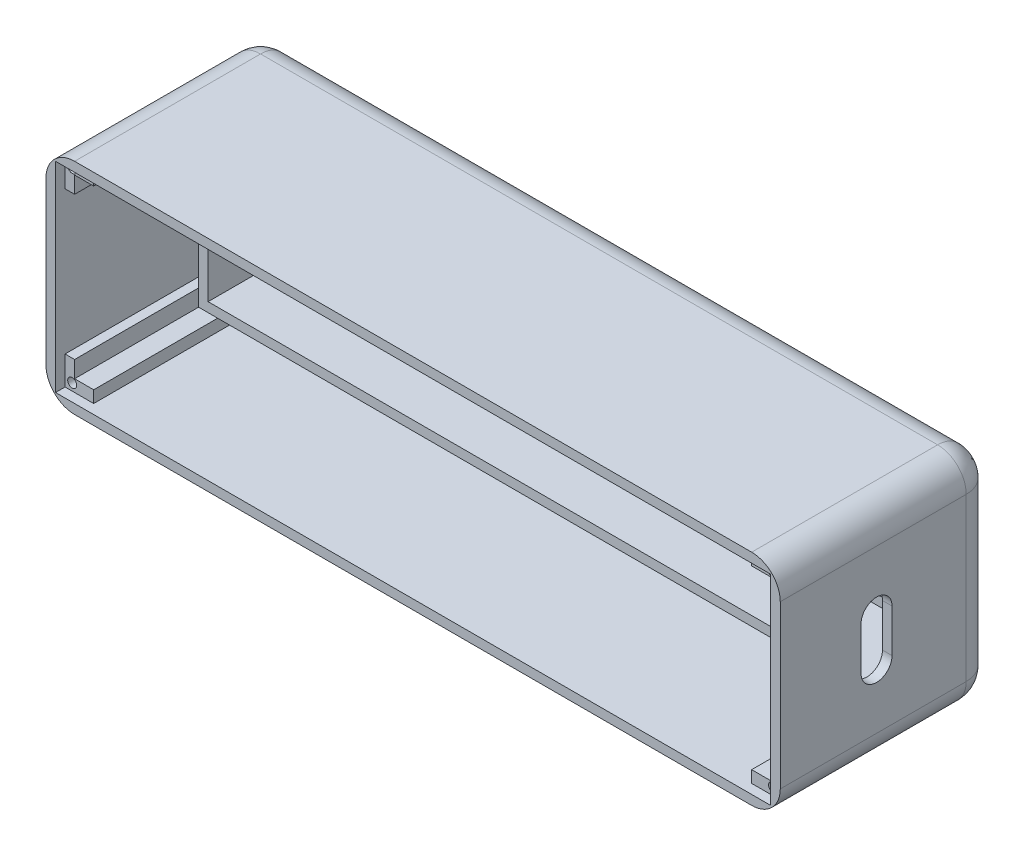
from build123d import *

# Parameters (mm, degrees)
SKETCH_1_W          = 154
SKETCH_1_H          = 46
SKETCH_1_W_2        = 150
SKETCH_1_H_2        = 42
EXTRUDE_1_DEPTH     = 43
SKETCH_2_W          = 154
SKETCH_2_H          = 46
EXTRUDE_2_DEPTH     = 2
SKETCH_3_W          = 137.467290134
SKETCH_3_H          = 29
CUT_EXTRUDE_1_DEPTH = 2
SKETCH_3_4_W        = 146
SKETCH_3_4_H        = 37
SKETCH_3_4_W_2      = 142
SKETCH_3_4_H_2      = 33
EXTRUDE_3_DEPTH     = 15
EXTRUDE_9_DEPTH     = 41
SKETCH_8_R          = 0.95
CUT_EXTRUDE_2_DEPTH = 41
FILLET_2_R          = 6
FILLET_3_R          = 6
CUT_EXTRUDE_3_DEPTH = 41


with BuildPart() as part:
    # 草图1 → 凸台-拉伸1 (new body)
    with BuildSketch(Plane.XY):
        with Locations((1.242355366, -16.575185829)):
            Rectangle(SKETCH_1_W, SKETCH_1_H)
        with Locations((1.242355366, -16.575185829)):
            Rectangle(SKETCH_1_W_2, SKETCH_1_H_2, mode=Mode.SUBTRACT)
    extrude(amount=EXTRUDE_1_DEPTH)

    # 草图2 → 凸台-拉伸2 (add)
    with BuildSketch(Plane(origin=(0, 0, 0), x_dir=(-1, 0, 0), z_dir=(0, 0, -1))):
        with Locations((-1.242355366, -16.575185829)):
            Rectangle(SKETCH_2_W, SKETCH_2_H)
    extrude(amount=EXTRUDE_2_DEPTH)

    # 草图3 → 切除-拉伸1 (cut)
    with BuildSketch(Plane.XY):
        with Locations((1.508710299, -16.575185829)):
            Rectangle(SKETCH_3_W, SKETCH_3_H)
    extrude(amount=-CUT_EXTRUDE_1_DEPTH, mode=Mode.SUBTRACT)

    # 草图3<4> → 凸台-拉伸3 (add)
    with BuildSketch(Plane.XY):
        with Locations((1.242355366, -16.575185829)):
            Rectangle(SKETCH_3_4_W, SKETCH_3_4_H)
        with Locations((1.242355366, -16.575185829)):
            Rectangle(SKETCH_3_4_W_2, SKETCH_3_4_H_2, mode=Mode.SUBTRACT)
    extrude(amount=EXTRUDE_3_DEPTH)

    # 草图7 → 凸台-拉伸9 (add)
    with BuildSketch(Plane.XY):
        Polygon((-73.757644634, 4.424814171), (-67.757644634, 4.424814171), (-67.757644634, 1.924814171), (-71.757644634, 1.924814171), (-71.757644634, -1.575185829), (-73.757644634, -1.575185829), align=None)
        Polygon((74.242355366, -1.575185829), (76.242355366, -1.575185829), (76.242355366, 4.424814171), (70.242355366, 4.424814171), (70.242355366, 1.924814171), (74.242355366, 1.924814171), align=None)
        Polygon((74.242355366, -35.075185829), (74.242355366, -31.575185829), (76.242355366, -31.575185829), (76.242355366, -37.575185829), (70.242355366, -37.575185829), (70.242355366, -35.075185829), align=None)
        Polygon((-71.757644634, -31.575185829), (-73.757644634, -31.575185829), (-73.757644634, -37.575185829), (-67.757644634, -37.575185829), (-67.757644634, -35.075185829), (-71.757644634, -35.075185829), align=None)
    extrude(amount=EXTRUDE_9_DEPTH)

    # 草图8 → 切除-拉伸2 (cut)
    with BuildSketch(Plane.XY.offset(41)):
        with Locations((-72.257644634, 2.924814171)):
            Circle(SKETCH_8_R)
        with Locations((-72.257644634, -36.075185829)):
            Circle(SKETCH_8_R)
        with Locations((74.742355366, -36.075185829)):
            Circle(SKETCH_8_R)
        with Locations((74.742355366, 2.924814171)):
            Circle(SKETCH_8_R)
    extrude(amount=-CUT_EXTRUDE_2_DEPTH, mode=Mode.SUBTRACT)

    # 圆角2
    fillet_2_edges = [part.edges().sort_by_distance(p)[0] for p in [
        (78.242355366, -39.575185829, 20.5),
        (78.242355366, 6.424814171, 20.5),
        (-75.757644634, -39.575185829, 20.5),
        (-75.757644634, 6.424814171, 20.5),
    ]]
    fillet(fillet_2_edges, radius=FILLET_2_R)

    # 圆角3
    fillet_3_edges = [part.edges().sort_by_distance(p)[0] for p in [
        (76.484996053, 4.667454858, -2),
        (1.242355366, 6.424814171, -2),
        (-74.000285321, 4.667454858, -2),
        (-75.757644634, -16.575185829, -2),
        (-74.000285321, -37.817826516, -2),
        (1.242355366, -39.575185829, -2),
        (76.484996053, -37.817826516, -2),
        (78.242355366, -16.575185829, -2),
    ]]
    fillet(fillet_3_edges, radius=FILLET_3_R)

    # 草图12 → 切除-拉伸3 (cut)
    with BuildSketch(Plane.ZY.offset(-76.242355366)):
        with BuildLine():
            Line((26.061737121, -12.075185829), (26.061737121, -21.075185829))
            ThreePointArc((26.061737121, -21.075185829), (22.811737121, -24.325185829), (19.561737121, -21.075185829))
            Line((19.561737121, -21.075185829), (19.561737121, -12.075185829))
            ThreePointArc((19.561737121, -12.075185829), (22.811737121, -8.825185829), (26.061737121, -12.075185829))
        make_face()
    extrude(amount=-CUT_EXTRUDE_3_DEPTH, mode=Mode.SUBTRACT)


solid = part.part
